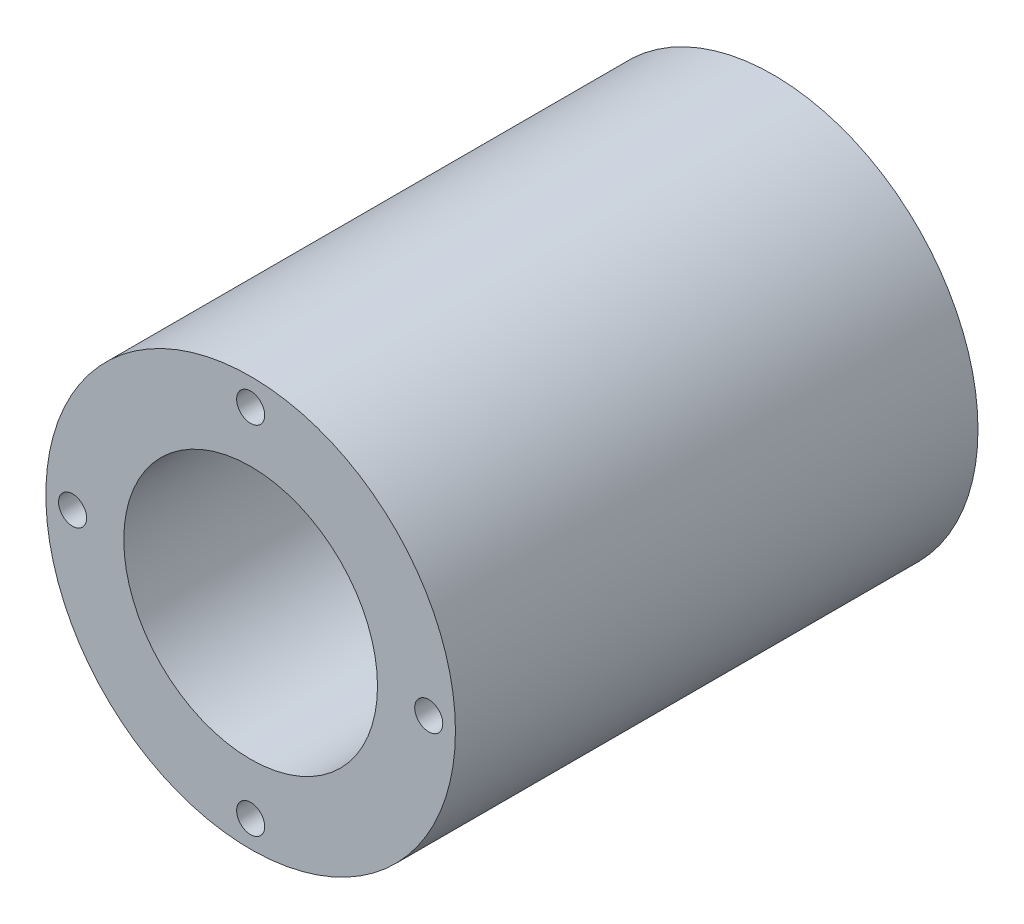
from build123d import *

# Parameters (mm, degrees)
SKETCH1_W              = 93.16400014
SKETCH1_H              = 13.8938
BACKFACEPATTERN_COUNT  = 6
FRONTFACEPATTERN_COUNT = 4


with BuildPart() as part:
    # Sketch1 → Revolve1 (revolve)
    with BuildSketch(Plane(origin=(0, 0, 0), x_dir=(0, 0, -1), z_dir=(1, 0, 0)), mode=Mode.PRIVATE) as revolve1_sk:
        with Locations((-72.887000006, 29.5656)):
            Rectangle(SKETCH1_W, SKETCH1_H)
    revolve(revolve1_sk.sketch.rotate(Axis((0, 0, 119.469000076), (0, 0, -1)), 90), axis=Axis((0, 0, 119.469000076), (0, 0, -1)))

    # Sketch9 → M6x1.0 Tapped Hole3 (revolve, cut)
    with BuildSketch(Plane(origin=(0, 30.565600032, 26.304999936), x_dir=(0, 1, 0), z_dir=(1, 0, 0))):
        Polygon((0, 0), (0, 16.502151548), (2.5, 15), (2.5, 0), align=None)
    m6x1_0_tapped_hole3 = revolve(axis=Axis((0, 30.565600032, 19.954999936), (0, 0, 1)), mode=Mode.SUBTRACT)

    # BackFacePattern: M6x1.0 Tapped Hole3 ×6 about axis
    backfacepattern_axis = Axis((0, 0, 0), (0, 0, 1))
    for i in range(1, BACKFACEPATTERN_COUNT):
        add(m6x1_0_tapped_hole3.rotate(backfacepattern_axis, i * 360 / BACKFACEPATTERN_COUNT), mode=Mode.SUBTRACT)

    # Sketch6 → M6x1.0 Tapped Hole2 (revolve, cut)
    with BuildSketch(Plane(origin=(0, 31.75, 119.469000076), x_dir=(0, -1, 0), z_dir=(1, 0, 0))):
        Polygon((0, 0), (0, 16.502151548), (2.5, 15), (2.5, 0), align=None)
    m6x1_0_tapped_hole2 = revolve(axis=Axis((0, 31.75, 125.819000076), (0, 0, -1)), mode=Mode.SUBTRACT)

    # FrontFacePattern: M6x1.0 Tapped Hole2 ×4 about axis
    frontfacepattern_axis = Axis((0, 0, 0), (0, 0, 1))
    for i in range(1, FRONTFACEPATTERN_COUNT):
        add(m6x1_0_tapped_hole2.rotate(frontfacepattern_axis, i * 360 / FRONTFACEPATTERN_COUNT), mode=Mode.SUBTRACT)


solid = part.part
